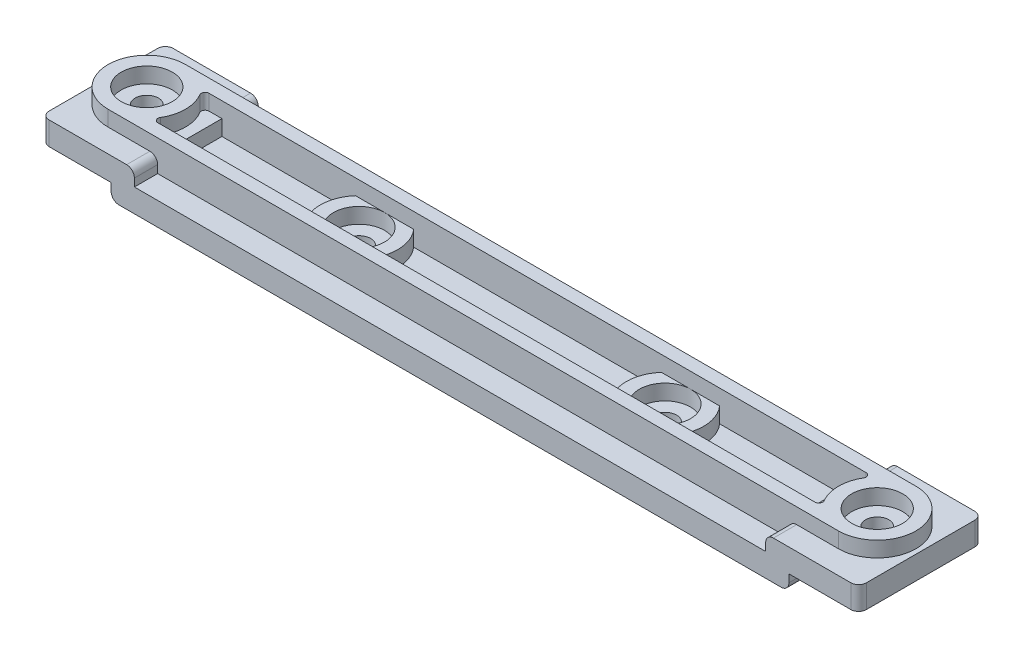
from build123d import *

# Parameters (mm, degrees)
SKETCH_1_W          = 105.5
SKETCH_1_H          = 16
EXTRUDE_1_DEPTH     = 5
SKETCH_2_W          = 81.5
SKETCH_2_H          = 2
CUT_EXTRUDE_1_DEPTH = 16
SKETCH_5_R          = 1.5
CUT_EXTRUDE_2_DEPTH = 5
SKETCH_6_R          = 3.3
EXTRUDE_3_DEPTH     = 7
SKETCH_7_R          = 5
SKETCH_7_R_2        = 3.3
EXTRUDE_4_DEPTH     = 5
SKETCH_8_W          = 9
SKETCH_8_H          = 2
CUT_EXTRUDE_3_DEPTH = 16
FILLET_1_R          = 1
FILLET_2_R          = 1


with BuildPart() as part:
    # 草图1 → 凸台-拉伸1 (new body)
    with BuildSketch(Plane(origin=(0, 0, 0), x_dir=(1, 0, 0), z_dir=(0, 1, 0))):
        Rectangle(SKETCH_1_W, SKETCH_1_H)
    extrude(amount=EXTRUDE_1_DEPTH)

    # 草图2 → 切除-拉伸1 (cut)
    with BuildSketch(Plane.XY.offset(8)):
        with Locations((0, 4)):
            Rectangle(SKETCH_2_W, SKETCH_2_H)
    extrude(amount=-CUT_EXTRUDE_1_DEPTH, mode=Mode.SUBTRACT)

    # 草图5 → 切除-拉伸2 (cut)
    with BuildSketch(Plane.XZ):
        with Locations(Location((-47.15, 0, 0), (0, 0, 270))):
            Circle(SKETCH_5_R)
        with Locations(Location((47.15, 0, 0), (0, 0, 270))):
            Circle(SKETCH_5_R)
        with Locations(Location((-19.75, 0, 0), (0, 0, 270))):
            Circle(SKETCH_5_R)
        with Locations(Location((19.75, 0, 0), (0, 0, 270))):
            Circle(SKETCH_5_R)
    extrude(amount=-CUT_EXTRUDE_2_DEPTH, mode=Mode.SUBTRACT)

    # 草图6 → 凸台-拉伸3 (add)
    with BuildSketch(Plane.XZ):
        with BuildLine():
            Line((-47.15, 5), (47.15, 5))
            ThreePointArc((47.15, 5), (52.15, 0), (47.15, -5))
            Line((47.15, -5), (-47.15, -5))
            ThreePointArc((-47.15, -5), (-52.15, 0), (-47.15, 5))
        make_face()
        with Locations(Location((-47.15, 0, 0), (0, 0, 270))):
            Circle(SKETCH_6_R, mode=Mode.SUBTRACT)
        with Locations(Location((47.15, 0, 0), (0, 0, 270))):
            Circle(SKETCH_6_R, mode=Mode.SUBTRACT)
        with BuildLine():
            ThreePointArc((42.846436226, 2.545454545), (42.850402728, 3.047716847), (42.416079849, 3.3))
            Line((42.416079849, 3.3), (-42.416079849, 3.3))
            ThreePointArc((-42.416079849, 3.3), (-42.850402728, 3.047716847), (-42.846436226, 2.545454545))
            ThreePointArc((-42.846436226, 2.545454545), (-42.15, 0), (-42.846436226, -2.545454545))
            ThreePointArc((-42.846436226, -2.545454545), (-42.850402728, -3.047716847), (-42.416079849, -3.3))
            Line((-42.416079849, -3.3), (42.416079849, -3.3))
            ThreePointArc((42.416079849, -3.3), (42.850402728, -3.047716847), (42.846436226, -2.545454545))
            ThreePointArc((42.846436226, -2.545454545), (42.15, 0), (42.846436226, 2.545454545))
        make_face(mode=Mode.SUBTRACT)
    extrude(amount=-EXTRUDE_3_DEPTH)

    # 草图7 → 凸台-拉伸4 (add)
    # profile 1 of 2: a face of its own
    with BuildSketch(Plane.XZ):
        with Locations((-19.75, 0)):
            Circle(SKETCH_7_R)
        with Locations(Location((-19.75, 0, 0), (0, 0, 270))):
            Circle(SKETCH_7_R_2, mode=Mode.SUBTRACT)
    # profile 2 of 2: a face of its own
    with BuildSketch(Plane.XZ):
        with Locations((19.75, 0)):
            Circle(SKETCH_7_R)
        with Locations(Location((19.75, 0, 0), (0, 0, 270))):
            Circle(SKETCH_7_R_2, mode=Mode.SUBTRACT)
    extrude(amount=-EXTRUDE_4_DEPTH)

    # 草图8 → 切除-拉伸3 (cut)
    with BuildSketch(Plane.XY.offset(8)):
        with Locations((-48.25, 1)):
            Rectangle(SKETCH_8_W, SKETCH_8_H)
        with Locations((48.25, 1)):
            Rectangle(SKETCH_8_W, SKETCH_8_H)
    extrude(amount=-CUT_EXTRUDE_3_DEPTH, mode=Mode.SUBTRACT)

    # 圆角1
    fillet_1_edges = [part.edges().sort_by_distance(p)[0] for p in [
        (-43.75, 0, 0),
        (43.75, 0, 0),
        (52.75, 3.5, 8),
        (-52.75, 3.5, 8),
        (-52.75, 3.5, -8),
        (52.75, 3.5, -8),
    ]]
    fillet(fillet_1_edges, radius=FILLET_1_R)

    # 圆角2
    fillet_2_edges = [part.edges().sort_by_distance(p)[0] for p in [
        (40.75, 5, -6.5),
        (-40.75, 5, -6.5),
        (-40.75, 5, 6.5),
        (40.75, 5, 6.5),
    ]]
    fillet(fillet_2_edges, radius=FILLET_2_R)


solid = part.part
